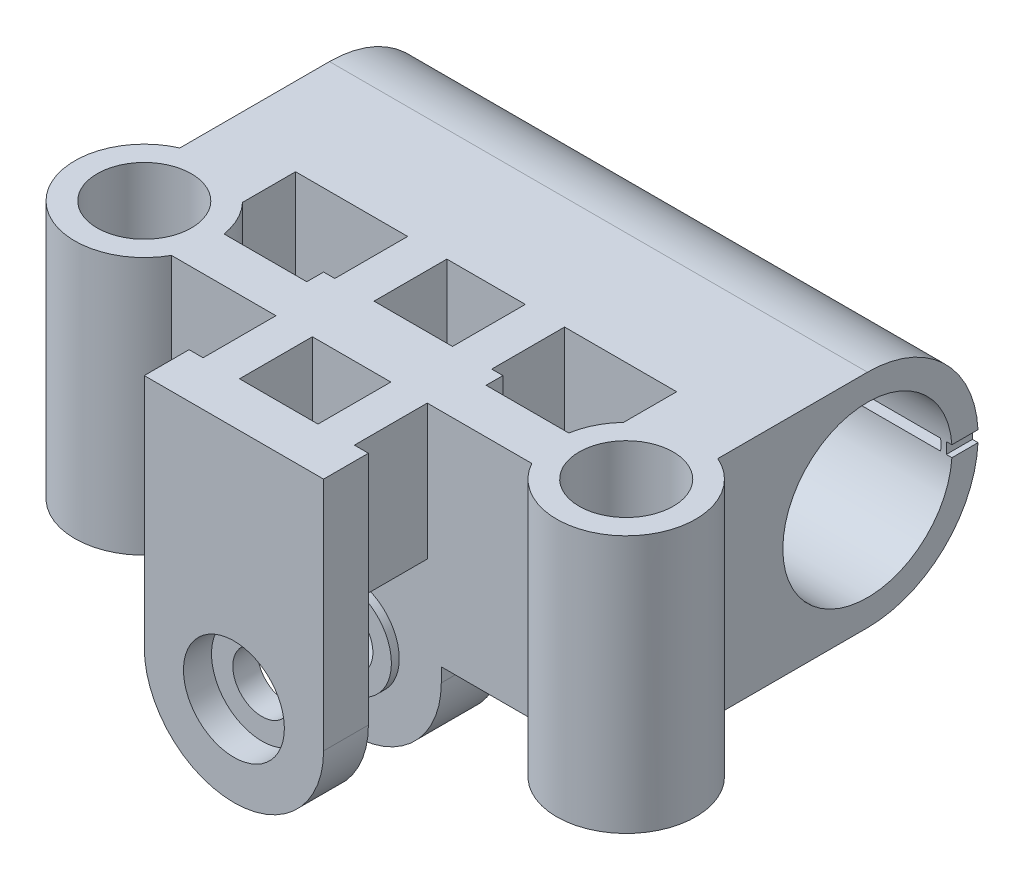
from build123d import *
from build123d.topology import SkipClean

# Parameters (mm, degrees)
BOSS_EXTRUDE1_DEPTH      = 19.75
FILLET1_RADIUS           = 9.875
FILLET1_LENGTH           = 48
SKETCH2_R                = 7.55
CUT_EXTRUDE1_DEPTH       = 70.718810231
BOSS_EXTRUDE2_START      = -23
SKETCH3_R                = 6.2
BOSS_EXTRUDE2_DEPTH      = 23
SKETCH4_R                = 4.2
CUT_EXTRUDE2_DEPTH       = 56.624185387
SKETCH5_W                = 7
SKETCH5_H                = 6.5
CUT_EXTRUDE3_DEPTH       = 56.624185387
BOSS_EXTRUDE3_DEPTH      = 4
CUT_EXTRUDE4_REACH       = 60.092
SKETCH7_W                = 6.5
SKETCH7_H                = 7.7
BOSS_EXTRUDE4_DEPTH      = 5.5
SKETCH9_W                = 6.5
SKETCH9_H                = 7.7
CUT_EXTRUDE5_DEPTH       = 14
BOSS_EXTRUDE5_DEPTH      = 4
BOSS_EXTRUDE6_REACH      = 53.302
SKETCH11_R               = 4.25
CUT_EXTRUDE7_DEPTH       = 55.36094646
CUT_EXTRUDE7_DEPTH_BACK  = 5
SKETCH13_W               = 8.5
SKETCH13_H               = 5.1
CUT_EXTRUDE8_DEPTH       = 2.5
CUT_EXTRUDE6_REACH       = 56.361
SKETCH12_R               = 2.6
BOSS_EXTRUDE7_REACH      = 45.123
BOSS_EXTRUDE7_END_RADIUS = 9.875
SKETCH17_W               = 2.341574484
SKETCH17_H               = 1
CUT_EXTRUDE9_DEPTH       = 70.718810231
BOSS_EXTRUDE8_START      = -1
BOSS_EXTRUDE8_DEPTH      = 0.5
LPATTERN1_COUNT          = 7
LPATTERN1_PITCH          = 7.75
SKETCH19_R               = 4.5
CUT_EXTRUDE10_DEPTH      = 2.5


with BuildPart() as part:
    # Sketch1 → Boss-Extrude1 (new body)
    with BuildSketch(Plane(origin=(0, 0, 0), x_dir=(1, 0, 0), z_dir=(0, 1, 0))):
        with BuildLine():
            Line((16.074136013, -31.9), (6.75, -31.9))
            Line((6.75, -31.9), (6.75, -38.4))
            Line((6.75, -38.4), (8, -38.4))
            Line((8, -38.4), (8, -42.4))
            Line((8, -42.4), (-8, -42.4))
            Line((-8, -42.4), (-8, -38.4))
            Line((-8, -38.4), (-6.75, -38.4))
            Line((-6.75, -38.4), (-6.75, -31.9))
            Line((-6.75, -31.9), (-16.074136013, -31.9))
            ThreePointArc((-16.074136013, -31.9), (-26.076909961, -33.082331313), (-24, -23.226376819))
            Line((-24, -23.226376819), (-24, 0))
            Line((-24, 0), (24, 0))
            Line((24, 0), (24, -23.226376819))
            ThreePointArc((24, -23.226376819), (26.076909961, -33.082331313), (16.074136013, -31.9))
        make_face()
    extrude(amount=BOSS_EXTRUDE1_DEPTH)

    # Fillet1: full round fillet: the end face becomes a half cylinder, R = half its width
    fillet1_face = Plane((0, 9.875, 0), x_dir=(1, 0, 0), z_dir=(0, 0, -1))  # on the end face: x along it, z out of the body
    fillet1_slab = fillet1_face.offset(-FILLET1_RADIUS / 2) * Box(FILLET1_LENGTH, 2 * FILLET1_RADIUS, FILLET1_RADIUS, mode=Mode.PRIVATE)  # the body's end, R deep
    fillet1_round = Plane((0, 9.875, 9.875), x_dir=(0, 0, -1), z_dir=(1, 0, 0)) * Cylinder(FILLET1_RADIUS, FILLET1_LENGTH, mode=Mode.PRIVATE)  # its axis R under the face
    add(fillet1_slab - fillet1_round, mode=Mode.SUBTRACT)

    # Sketch2 → Cut-Extrude1 (cut, through all)
    with BuildSketch(Plane(origin=(24, 0, 0), x_dir=(0, 0, -1), z_dir=(1, 0, 0))):
        with Locations((-9.875, 9.875)):
            Circle(SKETCH2_R)
    extrude(amount=-CUT_EXTRUDE1_DEPTH, mode=Mode.SUBTRACT)

    # Sketch3 → Boss-Extrude2 (add)
    with SkipClean():  # the faces are left unmerged after this step: merging them gives an invalid solid
        with BuildSketch(Plane(origin=(0, 19.75, 0), x_dir=(1, 0, 0), z_dir=(0, 1, 0)).offset(BOSS_EXTRUDE2_START)):
            with Locations(Location((21.5, -28.9, 0), (0, 0, 66.220005269))):
                Circle(SKETCH3_R)
            with Locations(Location((-21.5, -28.9, 0), (0, 0, 113.779994731))):
                Circle(SKETCH3_R)
        extrude(amount=BOSS_EXTRUDE2_DEPTH)

    # Sketch4 → Cut-Extrude2 (cut, through all)
    with SkipClean():  # the faces are left unmerged after this step: merging them gives an invalid solid
        with BuildSketch(Plane(origin=(0, 19.75, 0), x_dir=(1, 0, 0), z_dir=(0, 1, 0))):
            with Locations(Location((-21.5, -28.9, 0), (0, 0, 270))):
                Circle(SKETCH4_R)
            with Locations(Location((21.5, -28.9, 0), (0, 0, 270))):
                Circle(SKETCH4_R)
        extrude(amount=-CUT_EXTRUDE2_DEPTH, mode=Mode.SUBTRACT)

    # Sketch5 → Cut-Extrude3 (cut, through all)
    with BuildSketch(Plane(origin=(0, 19.75, 0), x_dir=(1, 0, 0), z_dir=(0, 1, 0))):
        with Locations((0, -23.15)):
            Rectangle(SKETCH5_W, SKETCH5_H)
        with Locations((0, -35.15)):
            Rectangle(SKETCH5_W, SKETCH5_H)
        with BuildLine():
            Line((17, -19.9), (7, -19.9))
            Line((7, -19.9), (7, -26.4))
            Line((7, -26.4), (8, -26.4))
            Line((8, -26.4), (8, -27.9))
            Line((8, -27.9), (15.381176584, -27.9))
            ThreePointArc((15.381176584, -27.9), (15.945284357, -26.145887779), (17, -24.635026378))
            Line((17, -24.635026378), (17, -19.9))
        make_face()
        with BuildLine():
            Line((-7, -19.9), (-17, -19.9))
            Line((-17, -19.9), (-17, -24.635026378))
            ThreePointArc((-17, -24.635026378), (-15.945284357, -26.145887779), (-15.381176584, -27.9))
            Line((-15.381176584, -27.9), (-8, -27.9))
            Line((-8, -27.9), (-8, -26.4))
            Line((-8, -26.4), (-7, -26.4))
            Line((-7, -26.4), (-7, -19.9))
        make_face()
    extrude(amount=-CUT_EXTRUDE3_DEPTH, mode=Mode.SUBTRACT)

    # Sketch6 → Boss-Extrude3 (add)
    with BuildSketch(Plane.XY.offset(42.4)):
        with BuildLine():
            Line((-8, 0), (-8, -1.25))
            ThreePointArc((-8, -1.25), (0, -9.25), (8, -1.25))
            Line((8, -1.25), (8, 0))
            Line((8, 0), (-8, 0))
        make_face()
    extrude(amount=-BOSS_EXTRUDE3_DEPTH)

    # Cut-Extrude4: up to this face of the body (flat: up to its plane)
    cut_extrude4_end = Plane(part.part.faces().sort_by_distance((-6.75, 9.875, 35.15))[0])
    # Sketch7 → Cut-Extrude4 (cut, up to the picked face)
    with BuildSketch(Plane(origin=(6.75, 0, 0), x_dir=(0, 0, -1), z_dir=(1, 0, 0)), mode=Mode.PRIVATE) as cut_extrude4_sk1:
        with Locations((-35.15, 3.85)):
            Rectangle(SKETCH7_W, SKETCH7_H)
    cut_extrude4_tool1 = split(extrude(cut_extrude4_sk1.sketch, amount=-CUT_EXTRUDE4_REACH, mode=Mode.PRIVATE), bisect_by=cut_extrude4_end, keep=Keep.BOTH, mode=Mode.PRIVATE)
    add(cut_extrude4_tool1.solids().sort_by(Axis((6.75, 3.85, 35.15), (-1, 0, 0)))[0], mode=Mode.SUBTRACT)

    # Sketch8 → Boss-Extrude4 (add)
    with BuildSketch(Plane.XY.offset(31.9)):
        with BuildLine():
            Line((-8, -1.25), (-8, 0))
            Line((-8, 0), (8, 0))
            Line((8, 0), (8, -1.25))
            ThreePointArc((8, -1.25), (0, -9.25), (-8, -1.25))
        make_face()
    extrude(amount=-BOSS_EXTRUDE4_DEPTH)

    # Sketch9 → Cut-Extrude5 (cut)
    with BuildSketch(Plane(origin=(7, 0, 0), x_dir=(0, 0, -1), z_dir=(1, 0, 0))):
        with Locations((-23.15, 3.85)):
            Rectangle(SKETCH9_W, SKETCH9_H)
    extrude(amount=-CUT_EXTRUDE5_DEPTH, mode=Mode.SUBTRACT)

    # Sketch10 → Boss-Extrude5 (add)
    with BuildSketch(Plane.XY.offset(19.9)):
        with BuildLine():
            Line((-8, -1.25), (-8, 0))
            Line((-8, 0), (8, 0))
            Line((8, 0), (8, -1.25))
            ThreePointArc((8, -1.25), (0, -9.25), (-8, -1.25))
        make_face()
    extrude(amount=-BOSS_EXTRUDE5_DEPTH)

    # Boss-Extrude6: up to this face of the body (flat: up to its plane)
    boss_extrude6_end = Plane(part.part.faces().sort_by_distance((0, 13.725, 19.9))[0])
    # Sketch11 → Boss-Extrude6 (add, up to the picked face)
    with BuildSketch(Plane(origin=(0, 0, 38.4), x_dir=(-1, 0, 0), z_dir=(0, 0, -1)), mode=Mode.PRIVATE) as boss_extrude6_sk1:
        with Locations(Location((0, -1.25, 0), (0, 0, 180))):
            Circle(SKETCH11_R)
    boss_extrude6_tool1 = split(extrude(boss_extrude6_sk1.sketch, amount=BOSS_EXTRUDE6_REACH, mode=Mode.PRIVATE), bisect_by=boss_extrude6_end, keep=Keep.BOTH, mode=Mode.PRIVATE)
    add(boss_extrude6_tool1.solids().sort_by(Axis((0, -1.25, 38.4), (0, 0, -1)))[0])

    # Sketch13 → Cut-Extrude7 (cut, two sides: drawn at the far end of the back side and taken through both)
    with BuildSketch(Plane.XZ.offset(-CUT_EXTRUDE7_DEPTH_BACK)):
        with Locations((0, 35.15)):
            Rectangle(SKETCH13_W, SKETCH13_H)
        with Locations((0, 23.15)):
            Rectangle(SKETCH13_W, SKETCH13_H)
    extrude(amount=CUT_EXTRUDE7_DEPTH + CUT_EXTRUDE7_DEPTH_BACK, mode=Mode.SUBTRACT)

    # Sketch15 → Cut-Extrude8 (cut, symmetric)
    with BuildSketch(Plane(origin=(0, 0, 0), x_dir=(0, 0, -1), z_dir=(1, 0, 0))):
        with BuildLine():
            Line((-15.9, 0), (-15.9, 2.050998466))
            ThreePointArc((-15.9, 2.050998466), (-13.05726412, 0.526801239), (-9.875, 0))
            Line((-9.875, 0), (-15.9, 0))
        make_face()
    extrude(amount=CUT_EXTRUDE8_DEPTH, both=True, mode=Mode.SUBTRACT)

    # Cut-Extrude6: up to this face of the body (flat: up to its plane)
    cut_extrude6_end = Plane(part.part.faces().sort_by_distance((0, -3.978206263, 15.9))[0])
    # Sketch12 → Cut-Extrude6 (cut, up to the picked face)
    with BuildSketch(Plane.XY.offset(42.4), mode=Mode.PRIVATE) as cut_extrude6_sk1:
        with Locations((0, -1.25)):
            Circle(SKETCH12_R)
    cut_extrude6_tool1 = split(extrude(cut_extrude6_sk1.sketch, amount=-CUT_EXTRUDE6_REACH, mode=Mode.PRIVATE), bisect_by=cut_extrude6_end, keep=Keep.BOTH, mode=Mode.PRIVATE)
    add(cut_extrude6_tool1.solids().sort_by(Axis((0, -1.25, 42.4), (0, 0, -1)))[0], mode=Mode.SUBTRACT)

    # Boss-Extrude7: up to this cylinder (the profile starts outside it)
    boss_extrude7_end = Plane(origin=(2.389901, 9.875, 9.875), z_dir=(1, 0, 0)) * Cylinder(BOSS_EXTRUDE7_END_RADIUS, 110.996, mode=Mode.PRIVATE)
    # Sketch16 → Boss-Extrude7 (add, up to the surface)
    with BuildSketch(Plane(origin=(0, 0, 15.9), x_dir=(-1, 0, 0), z_dir=(0, 0, -1)), mode=Mode.PRIVATE) as boss_extrude7_sk1:
        with BuildLine():
            Line((-2.279802623, 0), (-2.5, 0))
            Line((-2.5, 0), (-2.5, 1.800187721))
            Line((-2.5, 1.800187721), (2.5, 1.800187721))
            Line((2.5, 1.800187721), (2.5, 0))
            Line((2.5, 0), (2.279802623, 0))
            ThreePointArc((2.279802623, 0), (0, 1.35), (-2.279802623, 0))
        make_face()
    boss_extrude7_tool1 = extrude(boss_extrude7_sk1.sketch, amount=BOSS_EXTRUDE7_REACH, mode=Mode.PRIVATE) - boss_extrude7_end
    add(boss_extrude7_tool1.solids().sort_by_distance((2.389901, 0.053142, 15.9))[0])

    # Sketch17 → Cut-Extrude9 (cut, through all)
    with BuildSketch(Plane.ZY.offset(24)):
        with Locations((1.170787242, 9.875)):
            Rectangle(SKETCH17_W, SKETCH17_H)
    extrude(amount=-CUT_EXTRUDE9_DEPTH, mode=Mode.SUBTRACT)

    # Sketch18 → Boss-Extrude8 (add)
    with BuildSketch(Plane.ZY.offset(24).offset(BOSS_EXTRUDE8_START)):
        with BuildLine():
            Line((0.012666351, 10.375), (2.341574484, 10.375))
            ThreePointArc((2.341574484, 10.375), (2.325, 9.875), (2.341574484, 9.375))
            Line((2.341574484, 9.375), (0.012666351, 9.375))
            ThreePointArc((0.012666351, 9.375), (0, 9.875), (0.012666351, 10.375))
        make_face()
    boss_extrude8 = extrude(amount=BOSS_EXTRUDE8_DEPTH)

    # LPattern1: Boss-Extrude8 ×7
    with Locations(*[(i * LPATTERN1_PITCH, 0, 0) for i in range(1, LPATTERN1_COUNT)]):
        add(boss_extrude8)

    # Sketch19 → Cut-Extrude10 (cut)
    with BuildSketch(Plane.XY.offset(42.4)):
        with Locations((0, -1.25)):
            Circle(SKETCH19_R)
    extrude(amount=-CUT_EXTRUDE10_DEPTH, mode=Mode.SUBTRACT)


solid = part.part
